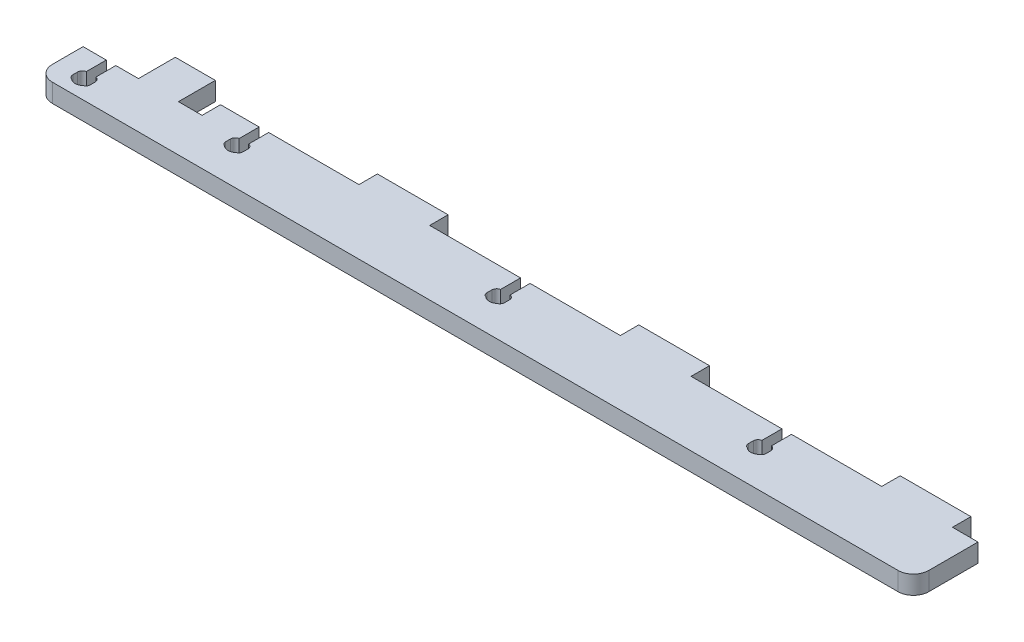
from build123d import *

# Parameters (mm, degrees)
SALIENTE_EXTRUIR1_DEPTH = 6


with BuildPart() as part:
    # Croquis1 → Saliente-Extruir1 (new body)
    with BuildSketch(Plane(origin=(0, 0, 0), x_dir=(1, 0, 0), z_dir=(0, 1, 0))):
        with BuildLine():
            Line((-122.476621199, -5.742358079), (-114.926621199, -5.742358079))
            Line((-114.926621199, -5.742358079), (-114.926621199, -12.242583321))
            ThreePointArc((-114.926621199, -12.242583321), (-115.851225833, -12.770672857), (-116.216958829, -13.770678689))
            Line((-116.216958829, -13.770678689), (-116.216958829, -15.320678689))
            ThreePointArc((-116.216958829, -15.320678689), (-116.028261999, -16.061862661), (-115.508115372, -16.622583321))
            Line((-115.508115372, -16.622583321), (-115.33887044, -16.622583321))
            ThreePointArc((-115.33887044, -16.622583321), (-113.376621199, -17.435593306), (-111.414371957, -16.622583321))
            Line((-111.414371957, -16.622583321), (-111.245127025, -16.622583321))
            ThreePointArc((-111.245127025, -16.622583321), (-110.724980398, -16.061862661), (-110.536283568, -15.320678689))
            Line((-110.536283568, -15.320678689), (-110.536283568, -13.770678689))
            ThreePointArc((-110.536283568, -13.770678689), (-110.902016564, -12.770672857), (-111.826621199, -12.242583321))
            Line((-111.826621199, -12.242583321), (-111.826621199, -5.742358079))
            Line((-111.826621199, -5.742358079), (-104.476621199, -5.742358079))
            Line((-104.476621199, -5.742358079), (-104.476621199, 6.257641921))
            Line((-104.476621199, 6.257641921), (-91.476621199, 6.257641921))
            Line((-91.476621199, 6.257641921), (-91.476621199, -5.742358079))
            Line((-91.476621199, -5.742358079), (-83.776621199, -5.742358079))
            Line((-83.776621199, -5.742358079), (-83.776621199, 0.257641921))
            Line((-83.776621199, 0.257641921), (-71.226621199, 0.257641921))
            Line((-71.226621199, 0.257641921), (-71.226621199, -6.242583321))
            ThreePointArc((-71.226621199, -6.242583321), (-72.151225833, -6.770672857), (-72.516958829, -7.770678689))
            Line((-72.516958829, -7.770678689), (-72.516958829, -9.320678689))
            ThreePointArc((-72.516958829, -9.320678689), (-72.328261999, -10.061862661), (-71.808115372, -10.622583321))
            Line((-71.808115372, -10.622583321), (-71.63887044, -10.622583321))
            ThreePointArc((-71.63887044, -10.622583321), (-69.676621199, -11.435593306), (-67.714371957, -10.622583321))
            Line((-67.714371957, -10.622583321), (-67.545127025, -10.622583321))
            ThreePointArc((-67.545127025, -10.622583321), (-67.024980398, -10.061862661), (-66.836283568, -9.320678689))
            Line((-66.836283568, -9.320678689), (-66.836283568, -7.770678689))
            ThreePointArc((-66.836283568, -7.770678689), (-67.202016564, -6.770672857), (-68.126621199, -6.242583321))
            Line((-68.126621199, -6.242583321), (-68.126621199, 0.257641921))
            Line((-68.126621199, 0.257641921), (-38.776621199, 0.257641921))
            Line((-38.776621199, 0.257641921), (-38.776621199, 6.257641921))
            Line((-38.776621199, 6.257641921), (-15.776621199, 6.257641921))
            Line((-15.776621199, 6.257641921), (-15.776621199, 0.257641921))
            Line((-15.776621199, 0.257641921), (13.773378801, 0.257641921))
            Line((13.773378801, 0.257641921), (13.773378801, -6.242583321))
            ThreePointArc((13.773378801, -6.242583321), (12.848774167, -6.770672857), (12.483041171, -7.770678689))
            Line((12.483041171, -7.770678689), (12.483041171, -9.320678689))
            ThreePointArc((12.483041171, -9.320678689), (12.671738001, -10.061862661), (13.191884628, -10.622583321))
            Line((13.191884628, -10.622583321), (13.36112956, -10.622583321))
            ThreePointArc((13.36112956, -10.622583321), (15.323378801, -11.435593306), (17.285628043, -10.622583321))
            Line((17.285628043, -10.622583321), (17.454872975, -10.622583321))
            ThreePointArc((17.454872975, -10.622583321), (17.975019602, -10.061862661), (18.163716432, -9.320678689))
            Line((18.163716432, -9.320678689), (18.163716432, -7.770678689))
            ThreePointArc((18.163716432, -7.770678689), (17.797983436, -6.770672857), (16.873378801, -6.242583321))
            Line((16.873378801, -6.242583321), (16.873378801, 0.257641921))
            Line((16.873378801, 0.257641921), (46.223378801, 0.257641921))
            Line((46.223378801, 0.257641921), (46.223378801, 6.257641921))
            Line((46.223378801, 6.257641921), (69.223378801, 6.257641921))
            Line((69.223378801, 6.257641921), (69.223378801, 0.257641921))
            Line((69.223378801, 0.257641921), (98.773378801, 0.257641921))
            Line((98.773378801, 0.257641921), (98.773378801, -6.242583321))
            ThreePointArc((98.773378801, -6.242583321), (97.848774167, -6.770672857), (97.483041171, -7.770678689))
            Line((97.483041171, -7.770678689), (97.483041171, -9.320678689))
            ThreePointArc((97.483041171, -9.320678689), (97.671738001, -10.061862661), (98.191884628, -10.622583321))
            Line((98.191884628, -10.622583321), (98.36112956, -10.622583321))
            ThreePointArc((98.36112956, -10.622583321), (100.323378801, -11.435593306), (102.285628043, -10.622583321))
            Line((102.285628043, -10.622583321), (102.454872975, -10.622583321))
            ThreePointArc((102.454872975, -10.622583321), (102.975019602, -10.061862661), (103.163716432, -9.320678689))
            Line((103.163716432, -9.320678689), (103.163716432, -7.770678689))
            ThreePointArc((103.163716432, -7.770678689), (102.797983436, -6.770672857), (101.873378801, -6.242583321))
            Line((101.873378801, -6.242583321), (101.873378801, 0.257641921))
            Line((101.873378801, 0.257641921), (131.223378801, 0.257641921))
            Line((131.223378801, 0.257641921), (131.223378801, 6.257641921))
            Line((131.223378801, 6.257641921), (154.223378801, 6.257641921))
            Line((154.223378801, 6.257641921), (154.223378801, 0.257641921))
            Line((154.223378801, 0.257641921), (162.523378801, 0.257641921))
            Line((162.523378801, 0.257641921), (162.523378801, -0.742358079))
            Line((162.523378801, -0.742358079), (162.523378801, -15.742358079))
            ThreePointArc((162.523378801, -15.742358079), (161.058912707, -19.277891985), (157.523378801, -20.742358079))
            Line((157.523378801, -20.742358079), (-117.476621199, -20.742358079))
            ThreePointArc((-117.476621199, -20.742358079), (-121.012155104, -19.277891985), (-122.476621199, -15.742358079))
            Line((-122.476621199, -15.742358079), (-122.476621199, -5.742358079))
        make_face()
    extrude(amount=SALIENTE_EXTRUIR1_DEPTH)


solid = part.part
